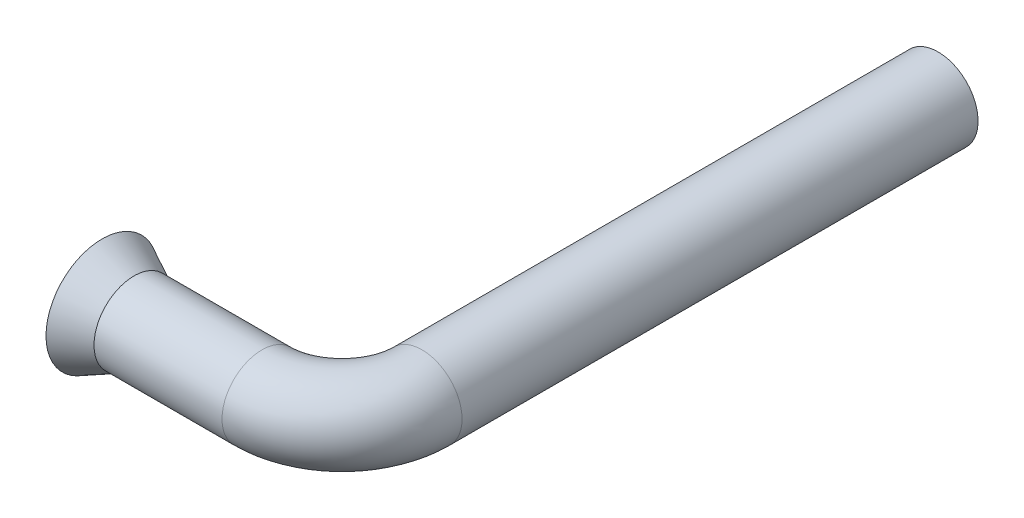
from build123d import *

# Parameters (mm, degrees)
SKETCH_2_R   = 5
SKETCH_2_R_2 = 4


with BuildPart() as part:
    # По траектории1: sweep along a path in Эскиз1
    with BuildLine(Plane(origin=(0, 0, 0), x_dir=(1, 0, 0), z_dir=(0, 1, 0))) as sweep_1_path:
        Line((0, 0), (20, 0))
        ThreePointArc((20, 0), (27.071067812, 2.928932188), (30, 10))
        Line((30, 10), (30, 74.5))
    # Эскиз2 → По траектории1 (sweep)
    with BuildSketch(Plane(origin=(0, 0, 0), x_dir=(0, 0, -1), z_dir=(1, 0, 0))):
        Circle(SKETCH_2_R)
        Circle(SKETCH_2_R_2, mode=Mode.SUBTRACT)
    sweep(path=sweep_1_path.line)

    # Эскиз3 → Повернуть1 (revolve)
    with BuildSketch(Plane.XY, mode=Mode.PRIVATE) as revolve_1_sk:
        Polygon((0, 7), (0, 4), (4, 4), (4, 5), align=None)
    revolve(revolve_1_sk.sketch.rotate(Axis((-3.453428096, 0, 0), (1, 0, 0)), 90), axis=Axis((-3.453428096, 0, 0), (1, 0, 0)))


solid = part.part
